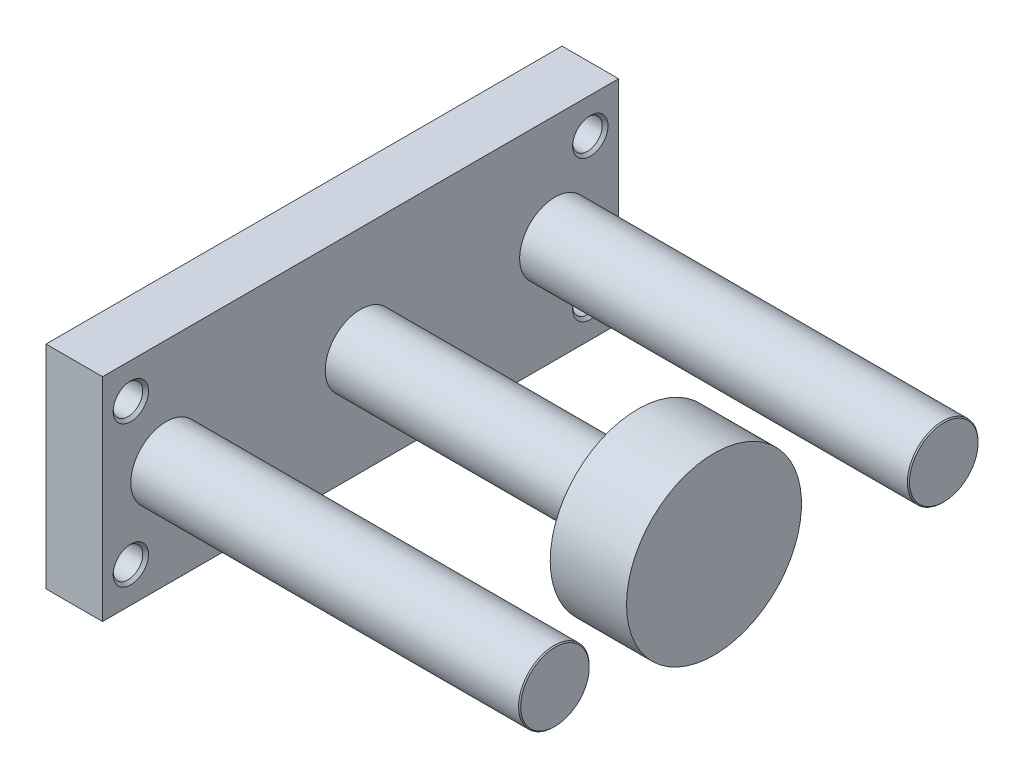
from build123d import *

# Parameters (mm, degrees)
SKETCH_1_W                  = 146
SKETCH_1_H                  = 60
EXTRUDE_1_DEPTH             = 16
PATTERN_LINEAR_1_COUNT      = 3
PATTERN_LINEAR_1_PITCH      = 55
PATTERN_LINEAR_2_COUNT      = 2
PATTERN_LINEAR_2_PITCH      = 130
PATTERN_LINEAR_2_COUNT_DIR2 = 2
PATTERN_LINEAR_2_PITCH_DIR2 = 40
SKETCH_9_W                  = 8
SKETCH_9_H                  = 2.5
HOLE_WIZARD_1_D             = 5
HOLE_WIZARD_1_DEPTH         = 8
HOLE_WIZARD_1_TIP           = 1.443375673
CUT_EXTRUDE_1_DEPTH         = 4


with BuildPart() as part:
    # 草图1 → 凸台-拉伸1 (new body)
    with BuildSketch(Plane(origin=(0, 0, 0), x_dir=(0, 0, -1), z_dir=(1, 0, 0))):
        Rectangle(SKETCH_1_W, SKETCH_1_H)
    extrude(amount=EXTRUDE_1_DEPTH)

    # 草图2 → 切除-旋转1 (revolve, cut)
    with BuildSketch(Plane.XY.offset(55)):
        Polygon((0, 0), (0, 9.5), (0.5, 9), (6.5, 9), (6.5, 8), (1, 8), (0.5, 7.5), (0.5, 0), align=None)
    cut_revolve_1 = revolve(axis=Axis((6.5, 0, 55), (-1, 0, 0)), mode=Mode.SUBTRACT)

    # 阵列(线性)1: 切除-旋转1 ×3
    with Locations(*[(0, 0, -i * PATTERN_LINEAR_1_PITCH) for i in range(1, PATTERN_LINEAR_1_COUNT)]):
        add(cut_revolve_1, mode=Mode.SUBTRACT)

    # 草图4 → 旋转1 (revolve)
    with BuildSketch(Plane.XY):
        Polygon((16, 0), (16, 10), (94.4, 10), (94.4, 24.75), (116, 24.75), (116, 0), align=None)
    revolve(axis=Axis((116, 0, 0), (-1, 0, 0)))

    # 草图5 → 旋转2 (revolve)
    with BuildSketch(Plane.XY.offset(55)):
        Polygon((16, 0), (16, 10), (125.7, 10), (126, 9.7), (126, 0), align=None)
    revolve(axis=Axis((126, 0, 55), (-1, 0, 0)))

    # 草图6 → 旋转3 (revolve)
    with BuildSketch(Plane.XY.offset(-55)):
        Polygon((16, 0), (16, 10), (125.7, 10), (126, 9.7), (126, 0), align=None)
    revolve(axis=Axis((126, 0, -55), (-1, 0, 0)))

    # 草图7 → 切除-旋转2 (revolve, cut)
    with BuildSketch(Plane.XY.offset(65)):
        Polygon((0, -20), (0, -15), (0.812, -15.812), (15.188, -15.812), (16, -15), (16, -20), align=None)
    cut_revolve_2 = revolve(axis=Axis((16, -20, 65), (-1, 0, 0)), mode=Mode.SUBTRACT)

    # 阵列(线性)2: Cut-Revolve 2 2 × 2
    with Locations(*[(0, j * PATTERN_LINEAR_2_PITCH_DIR2, -i * PATTERN_LINEAR_2_PITCH) for i in range(PATTERN_LINEAR_2_COUNT) for j in range(PATTERN_LINEAR_2_COUNT_DIR2) if (i, j) != (0, 0)]):
        add(cut_revolve_2, mode=Mode.SUBTRACT)

    # 草图9 → 切除-旋转3 (revolve, cut)
    with BuildSketch(Plane.XY.offset(33)):
        with Locations((4, 1.25)):
            Rectangle(SKETCH_9_W, SKETCH_9_H)
    revolve(axis=Axis((8, 0, 33), (-1, 0, 0)), mode=Mode.SUBTRACT)

    # 孔1
    with Locations(Plane.ZY):
        with Locations((-33, 0)):
            Hole(HOLE_WIZARD_1_D / 2, depth=HOLE_WIZARD_1_DEPTH)
            with Locations((0, 0, -(HOLE_WIZARD_1_DEPTH + HOLE_WIZARD_1_TIP / 2))):  # 120° drill point
                Cone(0, HOLE_WIZARD_1_D / 2, HOLE_WIZARD_1_TIP, mode=Mode.SUBTRACT)

    # 草图12 → 切除-拉伸1 (cut)
    with BuildSketch(Plane(origin=(0, 0, 0), x_dir=(0, 0, -1), z_dir=(1, 0, 0))):
        with BuildLine():
            Line((32.7, -2.5), (33.3, -2.5))
            ThreePointArc((33.3, -2.5), (35.8, 0), (33.3, 2.5))
            Line((33.3, 2.5), (32.7, 2.5))
            ThreePointArc((32.7, 2.5), (30.2, 0), (32.7, -2.5))
        make_face()
    extrude(amount=CUT_EXTRUDE_1_DEPTH, mode=Mode.SUBTRACT)


solid = part.part
